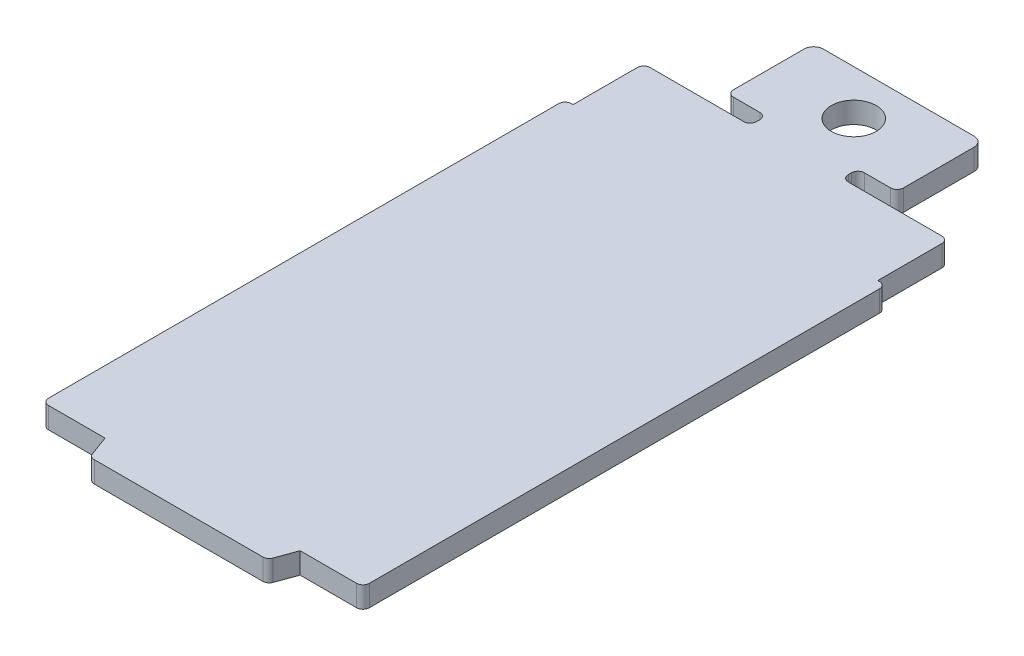
from build123d import *

# Parameters (mm, degrees)
SKETCH1_R           = 8.89
BOSS_EXTRUDE1_DEPTH = 8.382
SKETCH15_W          = 3.175
SKETCH15_H          = 27.94
CUT_EXTRUDE14_DEPTH = 238.219932461
FILLET4_R           = 2.54


with BuildPart() as part:
    # Sketch1 → Boss-Extrude1 (new body)
    with BuildSketch(Plane(origin=(0, 0, 0), x_dir=(1, 0, 0), z_dir=(0, 1, 0))):
        with BuildLine():
            Line((-15.926997076, 224.074744797), (43.763002924, 224.074744797))
            ThreePointArc((43.763002924, 224.074744797), (46.457079761, 222.958821634), (47.573002924, 220.264744797))
            Line((47.573002924, 220.264744797), (47.573002924, 192.324744797))
            ThreePointArc((47.573002924, 192.324744797), (46.829054148, 190.528693573), (45.033002924, 189.784744797))
            Line((45.033002924, 189.784744797), (34.619002924, 189.784744797))
            ThreePointArc((34.619002924, 189.784744797), (32.8229517, 189.040796021), (32.079002924, 187.244744797))
            Line((32.079002924, 187.244744797), (32.079002924, 185.974744797))
            ThreePointArc((32.079002924, 185.974744797), (32.8229517, 184.178693573), (34.619002924, 183.434744797))
            Line((34.619002924, 183.434744797), (74.878002924, 183.434744797))
            ThreePointArc((74.878002924, 183.434744797), (76.674054148, 182.690796021), (77.418002924, 180.894744797))
            Line((77.418002924, 180.894744797), (77.418002924, -51.515255203))
            Line((77.418002924, -51.515255203), (52.526002924, -51.515255203))
            Line((52.526002924, -51.515255203), (49.667478553, -59.368986367))
            ThreePointArc((49.667478553, -59.368986367), (48.737543444, -60.580901395), (47.280659296, -61.040255203))
            Line((47.280659296, -61.040255203), (-19.444653447, -61.040255203))
            ThreePointArc((-19.444653447, -61.040255203), (-20.901537596, -60.580901395), (-21.831472704, -59.368986367))
            Line((-21.831472704, -59.368986367), (-24.689997076, -51.515255203))
            Line((-24.689997076, -51.515255203), (-49.581997076, -51.515255203))
            Line((-49.581997076, -51.515255203), (-49.581997076, 180.894744797))
            ThreePointArc((-49.581997076, 180.894744797), (-48.8380483, 182.690796021), (-47.041997076, 183.434744797))
            Line((-47.041997076, 183.434744797), (-6.782997076, 183.434744797))
            ThreePointArc((-6.782997076, 183.434744797), (-4.986945852, 184.178693573), (-4.242997076, 185.974744797))
            Line((-4.242997076, 185.974744797), (-4.242997076, 187.244744797))
            ThreePointArc((-4.242997076, 187.244744797), (-4.986945852, 189.040796021), (-6.782997076, 189.784744797))
            Line((-6.782997076, 189.784744797), (-17.196997076, 189.784744797))
            ThreePointArc((-17.196997076, 189.784744797), (-18.9930483, 190.528693573), (-19.736997076, 192.324744797))
            Line((-19.736997076, 192.324744797), (-19.736997076, 220.264744797))
            ThreePointArc((-19.736997076, 220.264744797), (-18.621073912, 222.958821634), (-15.926997076, 224.074744797))
        make_face()
        with Locations(Location((13.918002924, 206.294744797, 0), (0, 0, 270))):
            Circle(SKETCH1_R, mode=Mode.SUBTRACT)
    extrude(amount=BOSS_EXTRUDE1_DEPTH)

    # Sketch15 → Cut-Extrude14 (cut, through all)
    with BuildSketch(Plane(origin=(0, 8.382, 0), x_dir=(-1, 0, 0), z_dir=(0, 1, 0))):
        with Locations((47.994497076, -169.464744797)):
            Rectangle(SKETCH15_W, SKETCH15_H)
        with Locations((-75.830502924, -169.464744797)):
            Rectangle(SKETCH15_W, SKETCH15_H)
    extrude(amount=-CUT_EXTRUDE14_DEPTH, mode=Mode.SUBTRACT)

    # Fillet4
    fillet4_edges = [part.edges().sort_by_distance(p)[0] for p in [
        (74.243002924, 4.191, -183.434744797),
        (77.418002924, 4.191, -155.494744797),
        (-49.581997076, 4.191, 51.515255203),
        (77.418002924, 4.191, 51.515255203),
        (-49.581997076, 4.191, -155.494744797),
        (-46.406997076, 4.191, -183.434744797),
    ]]
    fillet(fillet4_edges, radius=FILLET4_R)


solid = part.part
